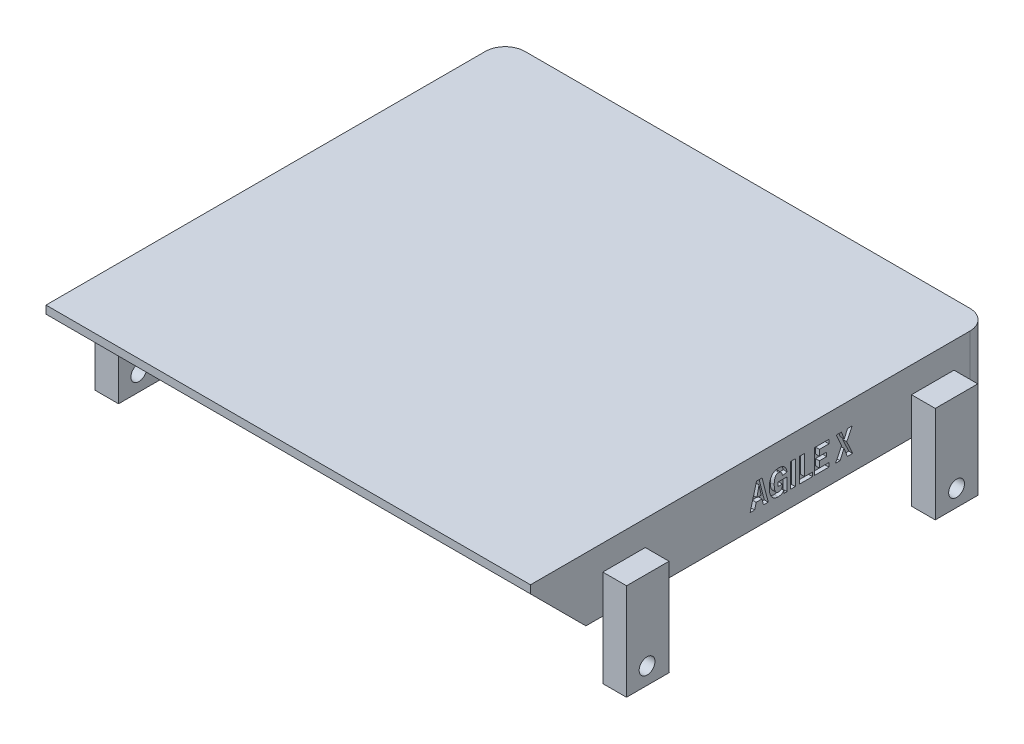
from build123d import *

# Parameters (mm, degrees)
SKETCH1_W           = 612
SKETCH1_H           = 580
BOSS_EXTRUDE1_DEPTH = 80
CHAMFER1_SIZE       = 70
FILLET2_R           = 25
CUT_EXTRUDE1_DEPTH  = 5
SKETCH3_W           = 6.25
SKETCH3_H           = 30.416666667
CUT_EXTRUDE2_DEPTH  = 5
SKETCH4_R           = 10
BOSS_EXTRUDE2_DEPTH = 30
BOSS_EXTRUDE3_START = 30
SKETCH6_W           = 54
SKETCH6_H           = 122
SKETCH6_R           = 10
BOSS_EXTRUDE3_DEPTH = 30


with BuildPart() as part:
    # Sketch1 → Boss-Extrude1 (new body)
    with BuildSketch(Plane(origin=(0, 0, 0), x_dir=(1, 0, 0), z_dir=(0, 1, 0))):
        with Locations((0, 83.030821918)):
            Rectangle(SKETCH1_W, SKETCH1_H)
    extrude(amount=BOSS_EXTRUDE1_DEPTH)

    # Chamfer1
    chamfer1_edges = [part.edges().sort_by_distance(p)[0] for p in [
        (0, 0, 206.969178082),
    ]]
    chamfer(chamfer1_edges, length=CHAMFER1_SIZE)

    # Fillet2
    fillet2_edges = [part.edges().sort_by_distance(p)[0] for p in [
        (-306, 40, -373.030821918),
        (306, 40, -373.030821918),
    ]]
    fillet(fillet2_edges, radius=FILLET2_R)

    # Sketch2 → Cut-Extrude1 (cut)
    # profile 1 of 7: a face of its own
    with BuildSketch(Plane(origin=(0, -68.484589041, 68.484589041), x_dir=(1, 0, 0), z_dir=(0, -0.707106781186549, 0.707106781186546))):
        with BuildLine():
            Line((-47.669619664, 159.046095654), (-52.936546748, 157.333856071))
            add(Edge.make_bspline(
                [(-52.936546748, 157.333856071), (-53.068046863, 157.729443988), (-53.313262961, 158.467120339), (-53.763551866, 159.457045715), (-54.233218552, 160.26316042), (-54.743787602, 160.897229984), (-55.328460328, 161.373021006), (-56.007950138, 161.691260127), (-56.780263593, 161.883319174), (-57.325550467, 161.905550553), (-57.611025914, 161.917189404)],
                knots=[0, 0, 0, 0, 1.402246929, 2.61485337, 3.653289749, 4.535177843, 5.340514958, 6.16703673, 7.040383995, 8, 8, 8, 8], degree=3))
            add(Edge.make_bspline(
                [(-57.611025914, 161.917189404), (-57.824974633, 161.906598538), (-58.236327014, 161.886235818), (-58.821537211, 161.710160408), (-59.341477043, 161.41867419), (-59.781687212, 161.010144928), (-60.139868753, 160.523509876), (-60.398320043, 159.96813141), (-60.55932493, 159.354558371), (-60.577111895, 158.923421839), (-60.586286331, 158.701043571)],
                knots=[0, 0, 0, 0, 1.044354365, 2.007946849, 2.958300523, 3.934837063, 4.921812007, 5.894998498, 6.914249768, 8, 8, 8, 8], degree=3))
            add(Edge.make_bspline(
                [(-60.586286331, 158.701043571), (-60.57422555, 158.46322085), (-60.551009224, 158.005425451), (-60.360981821, 157.358910276), (-60.032606504, 156.801210971), (-59.648686452, 156.41427141), (-59.270697907, 156.131367409), (-58.908589267, 155.917666826), (-58.493643467, 155.669739066), (-58.000722544, 155.43015963), (-57.450056238, 155.156943744), (-56.823189984, 154.892538721), (-56.14029929, 154.591826763), (-55.656547602, 154.404375349), (-55.403994664, 154.306512321)],
                knots=[0, 0, 0, 0, 1.172216551, 2.256451115, 3.288663753, 4.333795424, 4.922807237, 5.615277932, 6.406970191, 7.307380183, 8.318034558, 9.440214458, 10.663609091, 12, 12, 12, 12], degree=3))
            add(Edge.make_bspline(
                [(-55.403994664, 154.306512321), (-54.907821465, 154.10806428), (-53.969720475, 153.732864041), (-52.665037286, 153.15153094), (-51.546053284, 152.577282367), (-50.58358355, 152.015218506), (-49.753512469, 151.405779676), (-49.025303994, 150.720629948), (-48.39321841, 149.935481284), (-47.838593164, 149.079247799), (-47.383751571, 148.1468238), (-47.067412852, 147.144262717), (-46.872718699, 146.082712679), (-46.84861522, 145.355542161), (-46.836286331, 144.983595654)],
                knots=[0, 0, 0, 0, 1.409601274, 2.665094267, 3.766011238, 4.726167811, 5.602043479, 6.476721061, 7.3555848, 8.254339982, 9.163265252, 10.082943167, 11.019428626, 12, 12, 12, 12], degree=3))
            add(Edge.make_bspline(
                [(-46.836286331, 144.983595654), (-46.845236351, 144.674961034), (-46.862902194, 144.065767937), (-46.997445547, 143.169445863), (-47.211606613, 142.30260374), (-47.518358712, 141.465881753), (-47.921002747, 140.66153876), (-48.403553836, 139.884661164), (-48.973981999, 139.138435015), (-49.628352711, 138.432529797), (-50.36071726, 137.780744711), (-51.173210065, 137.208649092), (-52.065627918, 136.734658115), (-53.029703763, 136.342116202), (-54.067712442, 136.036224686), (-55.182193824, 135.825204837), (-56.368694453, 135.692917898), (-57.185317223, 135.675916671), (-57.604515498, 135.667189404)],
                knots=[0, 0, 0, 0, 0.927273364, 1.830282462, 2.717705701, 3.607044279, 4.502508163, 5.416474009, 6.351786542, 7.320982513, 8.30513949, 9.293092817, 10.299813176, 11.335361109, 12.416744679, 13.54621127, 14.740392699, 16, 16, 16, 16], degree=3))
            add(Edge.make_bspline(
                [(-57.604515498, 135.667189404), (-57.949927654, 135.671866196), (-58.625281983, 135.681010321), (-59.610561029, 135.798367479), (-60.545685889, 135.969528446), (-61.430546725, 136.218204741), (-62.264174028, 136.538260917), (-63.053404283, 136.92066586), (-63.785413757, 137.388711462), (-64.46969756, 137.922985576), (-65.10595404, 138.525300719), (-65.687013577, 139.200040029), (-66.216011054, 139.945857738), (-66.690528964, 140.765124054), (-67.119733867, 141.65053842), (-67.499094754, 142.607645417), (-67.822427319, 143.635906381), (-67.997013223, 144.351007382), (-68.086286331, 144.716668571)],
                knots=[0, 0, 0, 0, 1.08993429, 2.13105367, 3.128136037, 4.08903938, 5.028101157, 5.944288876, 6.852861716, 7.765661458, 8.681644202, 9.614310478, 10.572474108, 11.564269381, 12.600009197, 13.676378099, 14.811834491, 16, 16, 16, 16], degree=3))
            Line((-68.086286331, 144.716668571), (-62.389671748, 146.083856071))
            add(Edge.make_bspline(
                [(-62.389671748, 146.083856071), (-62.339830716, 145.864098797), (-62.243034823, 145.437309843), (-62.064529646, 144.823186383), (-61.873671907, 144.249030693), (-61.649194897, 143.720351557), (-61.410844862, 143.231738811), (-61.149123936, 142.784434055), (-60.864101392, 142.380998617), (-60.555057793, 142.021156939), (-60.230861366, 141.697101488), (-59.875284333, 141.425382525), (-59.50373817, 141.185470791), (-59.103266946, 140.999756933), (-58.686095712, 140.84640602), (-58.24623859, 140.745537286), (-57.78687916, 140.675669411), (-57.47241651, 140.670059347), (-57.311546748, 140.667189404)],
                knots=[0, 0, 0, 0, 1.330535481, 2.584022976, 3.775635058, 4.901540113, 5.973405712, 6.984548086, 7.958957425, 8.886202164, 9.783465393, 10.6602652, 11.524326317, 12.390001883, 13.261634327, 14.144502024, 15.050782285, 16, 16, 16, 16], degree=3))
            add(Edge.make_bspline(
                [(-57.311546748, 140.667189404), (-56.980338929, 140.677029279), (-56.356431453, 140.695564987), (-55.485428552, 140.902474831), (-54.735160117, 141.228235767), (-54.134436166, 141.710886458), (-53.668199838, 142.283149879), (-53.3302015, 142.927166457), (-53.119486197, 143.635957151), (-53.097514649, 144.131430895), (-53.086286331, 144.384637321)],
                knots=[0, 0, 0, 0, 1.248895472, 2.352587042, 3.361559477, 4.312925947, 5.233592161, 6.132088199, 7.045424151, 8, 8, 8, 8], degree=3))
            add(Edge.make_bspline(
                [(-53.086286331, 144.384637321), (-53.094594638, 144.572172777), (-53.111264091, 144.948436397), (-53.261618703, 145.498930109), (-53.502645101, 146.029068658), (-53.777067011, 146.45810491), (-54.076971726, 146.792704255), (-54.382669683, 147.055390468), (-54.768344765, 147.316842693), (-55.225423736, 147.589488029), (-55.756724931, 147.872092317), (-56.369062112, 148.151713488), (-57.051051978, 148.456511052), (-57.538404364, 148.642712202), (-57.793317581, 148.740106071)],
                knots=[0, 0, 0, 0, 0.979831158, 1.96589394, 2.962105149, 4.020392989, 4.615464502, 5.307704592, 6.123587612, 7.050601816, 8.092000183, 9.270601893, 10.572368426, 12, 12, 12, 12], degree=3))
            add(Edge.make_bspline(
                [(-57.793317581, 148.740106071), (-58.077867372, 148.850120066), (-58.628537164, 149.063022644), (-59.422670559, 149.382503333), (-60.157308064, 149.686066327), (-60.829198033, 149.981158728), (-61.443951956, 150.25783623), (-61.993684788, 150.534644675), (-62.491625513, 150.783268849), (-63.068469118, 151.115582245), (-63.733486843, 151.572345409), (-64.449918876, 152.241194792), (-65.121273782, 153.012895537), (-65.712285707, 153.901119704), (-66.218443066, 154.876051142), (-66.575534826, 155.936144037), (-66.797602439, 157.059833109), (-66.823219263, 157.831935788), (-66.836286331, 158.225783154)],
                knots=[0, 0, 0, 0, 1.033116979, 1.999320784, 2.898737521, 3.724784007, 4.484447603, 5.181218081, 5.808996273, 6.368686919, 7.434939515, 8.532418519, 9.678689388, 10.891468741, 12.137135469, 13.387476061, 14.66735902, 16, 16, 16, 16], degree=3))
            add(Edge.make_bspline(
                [(-66.836286331, 158.225783154), (-66.828841193, 158.525619621), (-66.814162087, 159.116788155), (-66.696200208, 159.985559567), (-66.493463221, 160.816248097), (-66.211135688, 161.609885522), (-65.853087171, 162.367937681), (-65.41171416, 163.088117301), (-64.896456636, 163.77587715), (-64.29924963, 164.415808918), (-63.636641745, 165.000331524), (-62.921713542, 165.517669298), (-62.150410242, 165.948202122), (-61.335307023, 166.310823312), (-60.462746842, 166.582222573), (-59.540799419, 166.776531425), (-58.569010784, 166.895804316), (-57.904336893, 166.909968034), (-57.565452998, 166.917189404)],
                knots=[0, 0, 0, 0, 1.010374096, 1.992090487, 2.948324196, 3.887622084, 4.82666361, 5.768776881, 6.729921826, 7.718481422, 8.713487715, 9.704101857, 10.686689868, 11.685613842, 12.705816172, 13.760266775, 14.858072314, 16, 16, 16, 16], degree=3))
            add(Edge.make_bspline(
                [(-57.565452998, 166.917189404), (-57.246231868, 166.910683973), (-56.623810354, 166.8979996), (-55.71161043, 166.806424101), (-54.845570837, 166.650363275), (-54.022575585, 166.435580897), (-53.242609712, 166.164260377), (-52.511002498, 165.820681163), (-51.817342598, 165.427673677), (-51.17508475, 164.958159723), (-50.577861286, 164.433037277), (-50.025339335, 163.845936866), (-49.515804422, 163.200193351), (-49.055409557, 162.487899446), (-48.63558109, 161.715964698), (-48.269525502, 160.879307078), (-47.931269417, 159.988794381), (-47.758000665, 159.364523844), (-47.669619664, 159.046095654)],
                knots=[0, 0, 0, 0, 1.110600657, 2.165463621, 3.185931529, 4.169413596, 5.122273899, 6.054660352, 6.978106896, 7.891871227, 8.817414554, 9.741478292, 10.693141157, 11.675376052, 12.688976763, 13.746969891, 14.85077341, 16, 16, 16, 16], degree=3))
        make_face()
    # profile 2 of 7: a face of its own
    with BuildSketch(Plane(origin=(0, -68.484589041, 68.484589041), x_dir=(1, 0, 0), z_dir=(0, -0.707106781186549, 0.707106781186546))):
        with BuildLine():
            Line((-28.021182164, 146.917189404), (-22.252952998, 146.181512321))
            add(Edge.make_bspline(
                [(-22.252952998, 146.181512321), (-22.320092876, 145.755375848), (-22.450581891, 144.927162721), (-22.715030051, 143.731476243), (-23.048546305, 142.620531602), (-23.437261985, 141.590179482), (-23.884025368, 140.63909373), (-24.40374506, 139.778636734), (-24.967252886, 138.988513597), (-25.604812105, 138.289519888), (-26.295409229, 137.668963253), (-27.043814947, 137.127478957), (-27.858765908, 136.677958751), (-28.731304927, 136.306826367), (-29.665623217, 136.019907017), (-30.654788438, 135.813423674), (-31.704941388, 135.68647365), (-32.424025922, 135.673732648), (-32.793317581, 135.667189404)],
                knots=[0, 0, 0, 0, 1.249385357, 2.428229969, 3.543891733, 4.606271744, 5.615669577, 6.582663251, 7.514362023, 8.42219658, 9.316944747, 10.19966651, 11.091672485, 12.007027399, 12.941499877, 13.917907229, 14.930724474, 16, 16, 16, 16], degree=3))
            add(Edge.make_bspline(
                [(-32.793317581, 135.667189404), (-33.249890043, 135.678122003), (-34.13526067, 135.699322148), (-35.417180547, 135.908157066), (-36.609536331, 136.236972902), (-37.715433181, 136.700479948), (-38.726648032, 137.305169943), (-39.645426757, 138.043991203), (-40.481373853, 138.907698751), (-41.204153615, 139.914232566), (-41.846948305, 141.018860016), (-42.397461735, 142.218877809), (-42.877663135, 143.498287918), (-43.256744048, 144.869890287), (-43.555369781, 146.325121908), (-43.769765756, 147.864529807), (-43.89152324, 149.491167577), (-43.910092818, 150.604052712), (-43.919619664, 151.175001904)],
                knots=[0, 0, 0, 0, 1.014679835, 1.967634486, 2.879863779, 3.76012518, 4.62591189, 5.491214183, 6.375277913, 7.290413538, 8.2398786, 9.213723471, 10.223167179, 11.275940032, 12.374873334, 13.524970968, 14.730223111, 16, 16, 16, 16], degree=3))
            add(Edge.make_bspline(
                [(-43.919619664, 151.175001904), (-43.911320105, 151.785066893), (-43.895171458, 152.972084736), (-43.757344363, 154.700595351), (-43.530346551, 156.322172135), (-43.225086345, 157.839374141), (-42.811737128, 159.241843531), (-42.32117845, 160.542325036), (-41.724738175, 161.730121167), (-41.0504001, 162.815831351), (-40.28866203, 163.785710723), (-39.437245757, 164.628443535), (-38.498042271, 165.332131782), (-37.489044451, 165.924037911), (-36.386653829, 166.362114858), (-35.211802888, 166.692076753), (-33.951661153, 166.879798424), (-33.086889295, 166.904517546), (-32.643577998, 166.917189404)],
                knots=[0, 0, 0, 0, 1.336722099, 2.600891725, 3.796662543, 4.923314773, 5.98874742, 6.997326191, 7.96499444, 8.896546895, 9.793732702, 10.661329326, 11.513527377, 12.359385929, 13.21687505, 14.105283766, 15.028704389, 16, 16, 16, 16], degree=3))
            add(Edge.make_bspline(
                [(-32.643577998, 166.917189404), (-32.280869337, 166.907576326), (-31.57283013, 166.888810753), (-30.538583078, 166.767677111), (-29.565841002, 166.549358039), (-28.646306641, 166.260595212), (-27.789524916, 165.872661242), (-26.989832511, 165.402115584), (-26.249896515, 164.844789193), (-25.568771272, 164.202743281), (-24.949279041, 163.472804996), (-24.379217573, 162.665162328), (-23.881248207, 161.764099832), (-23.42806238, 160.787376344), (-23.049946857, 159.71897253), (-22.713644574, 158.570836007), (-22.451757739, 157.333385573), (-22.320352311, 156.477352228), (-22.252952998, 156.038283154)],
                knots=[0, 0, 0, 0, 1.040169375, 2.030502107, 2.980212413, 3.895345935, 4.789438109, 5.671011458, 6.550957922, 7.44022922, 8.349440173, 9.292090098, 10.270086596, 11.297575872, 12.376345336, 13.516666938, 14.726270705, 16, 16, 16, 16], degree=3))
            Line((-22.252952998, 156.038283154), (-28.034202998, 155.250522737))
            add(Edge.make_bspline(
                [(-28.034202998, 155.250522737), (-28.069288348, 155.519875496), (-28.137371086, 156.042551572), (-28.266178872, 156.799119195), (-28.421878954, 157.50326923), (-28.602370393, 158.156119805), (-28.812584534, 158.75472595), (-29.035863732, 159.307280975), (-29.299209467, 159.80059409), (-29.577401056, 160.248138807), (-29.884682133, 160.641411167), (-30.217816197, 160.983397862), (-30.577457966, 161.270435284), (-30.958628754, 161.509150894), (-31.366076829, 161.692743557), (-31.799404796, 161.822810163), (-32.258659271, 161.903108819), (-32.573801281, 161.91242979), (-32.734723831, 161.917189404)],
                knots=[0, 0, 0, 0, 1.44906061, 2.811886229, 4.092776894, 5.295072586, 6.42281182, 7.476380238, 8.47071313, 9.402194461, 10.284607749, 11.127872692, 11.943338893, 12.733679525, 13.521301866, 14.319741845, 15.142001328, 16, 16, 16, 16], degree=3))
            add(Edge.make_bspline(
                [(-32.734723831, 161.917189404), (-32.934987118, 161.907726232), (-33.326414761, 161.889229846), (-33.895320756, 161.764710085), (-34.424811491, 161.54742909), (-34.908285006, 161.234574334), (-35.359478388, 160.845732961), (-35.761933851, 160.363312377), (-36.127698102, 159.798740514), (-36.449871637, 159.147692418), (-36.746687933, 158.416374256), (-36.986339015, 157.591900109), (-37.202196077, 156.686393008), (-37.377755806, 155.695320731), (-37.502096336, 154.618747027), (-37.601242826, 153.457344902), (-37.65909295, 152.20857477), (-37.666036118, 151.346502076), (-37.669619664, 150.901564404)],
                knots=[0, 0, 0, 0, 0.721707156, 1.410623662, 2.087534721, 2.773246533, 3.477446831, 4.226608229, 5.029348627, 5.896889418, 6.841025437, 7.870447894, 8.987931594, 10.195492518, 11.495574795, 12.892831787, 14.396311354, 16, 16, 16, 16], degree=3))
            add(Edge.make_bspline(
                [(-37.669619664, 150.901564404), (-37.6660482, 150.489173335), (-37.65912698, 149.689991629), (-37.600973985, 148.530146047), (-37.501933262, 147.449027522), (-37.378242662, 146.445950767), (-37.201915847, 145.524337089), (-36.98606515, 144.683897882), (-36.746048843, 143.917734552), (-36.449199784, 143.238472279), (-36.125835329, 142.633619949), (-35.762781599, 142.107435262), (-35.352360469, 141.665727618), (-34.909981031, 141.29549954), (-34.421588011, 141.010050259), (-33.891478204, 140.817619954), (-33.327074846, 140.685798237), (-32.935161028, 140.673486181), (-32.734723831, 140.667189404)],
                knots=[0, 0, 0, 0, 1.570196963, 3.042919158, 4.420193128, 5.703406983, 6.889682038, 7.989955834, 9.006459428, 9.942825837, 10.808054535, 11.614972758, 12.369277943, 13.097187235, 13.804400205, 14.510405295, 15.238173869, 16, 16, 16, 16], degree=3))
            add(Edge.make_bspline(
                [(-32.734723831, 140.667189404), (-32.565302675, 140.673161073), (-32.23604992, 140.684766404), (-31.756702696, 140.746666842), (-31.311743838, 140.866023793), (-30.898922872, 141.026448626), (-30.522725379, 141.240574917), (-30.175398288, 141.49188471), (-29.867367192, 141.799022391), (-29.584042218, 142.146996993), (-29.329055225, 142.550296894), (-29.098097862, 143.008379179), (-28.874225825, 143.520575478), (-28.668838671, 144.090600151), (-28.480490527, 144.716640705), (-28.312036674, 145.399473558), (-28.156918848, 146.138003913), (-28.067355, 146.652137966), (-28.021182164, 146.917189404)],
                knots=[0, 0, 0, 0, 0.937545461, 1.82202408, 2.66641249, 3.480034922, 4.264717236, 5.054615877, 5.844058324, 6.663328528, 7.532440888, 8.477334956, 9.49873695, 10.622766397, 11.826586643, 13.113428642, 14.511886372, 16, 16, 16, 16], degree=3))
        make_face()
    # profile 3 of 7: a face of its own
    with BuildSketch(Plane(origin=(0, -68.484589041, 68.484589041), x_dir=(1, 0, 0), z_dir=(0, -0.707106781186549, 0.707106781186546))):
        with BuildLine():
            add(Edge.make_bspline(
                [(3.163713669, 151.305210237), (3.155442568, 150.692974921), (3.139377013, 149.503786165), (3.001844057, 147.775234083), (2.774581109, 146.157941552), (2.468717331, 144.647485586), (2.056773534, 143.247868987), (1.558291233, 141.957301695), (0.970880639, 140.772299414), (0.288793372, 139.703880771), (-0.482716146, 138.749569565), (-1.349264395, 137.919765224), (-2.311216238, 137.220123535), (-3.365005425, 136.649518867), (-4.506069629, 136.203549409), (-5.742229726, 135.894970685), (-7.066848559, 135.703415483), (-7.981445906, 135.679476343), (-8.450869664, 135.667189404)],
                knots=[0, 0, 0, 0, 1.326950474, 2.57743149, 3.755596254, 4.865442852, 5.914825436, 6.914178502, 7.860850126, 8.776884433, 9.656290029, 10.514698441, 11.369982024, 12.226700311, 13.105489209, 14.018220213, 14.982837072, 16, 16, 16, 16], degree=3))
            add(Edge.make_bspline(
                [(-8.450869664, 135.667189404), (-8.896362274, 135.680130612), (-9.763009439, 135.705306025), (-11.023783556, 135.888089227), (-12.202085429, 136.199258977), (-13.297896982, 136.640085029), (-14.318948701, 137.195105743), (-15.254717746, 137.88427443), (-16.106786819, 138.700810801), (-16.878097754, 139.638039764), (-17.561932757, 140.695127655), (-18.146315769, 141.872933933), (-18.652248366, 143.1606963), (-19.045511594, 144.569916405), (-19.368499413, 146.089257119), (-19.590200589, 147.725638363), (-19.728855079, 149.477711475), (-19.744765168, 150.684274926), (-19.752952998, 151.305210237)],
                knots=[0, 0, 0, 0, 0.97710851, 1.900835841, 2.787711236, 3.644350247, 4.485934983, 5.330530572, 6.185819189, 7.068455028, 7.987521047, 8.941342163, 9.948299617, 11.018138869, 12.146992335, 13.353494975, 14.638025692, 16, 16, 16, 16], degree=3))
            add(Edge.make_bspline(
                [(-19.752952998, 151.305210237), (-19.745057389, 151.921839339), (-19.729745839, 153.117636555), (-19.587597034, 154.853833708), (-19.37607212, 156.478156938), (-19.053496297, 157.98687172), (-18.654624656, 159.3867428), (-18.159691598, 160.675351642), (-17.575817159, 161.853687075), (-16.895782853, 162.913929248), (-16.133407701, 163.859576252), (-15.281117908, 164.677779664), (-14.351198021, 165.37806754), (-13.328926857, 165.938620227), (-12.231185884, 166.38517693), (-11.047682962, 166.696840547), (-9.784657568, 166.878663137), (-8.915882992, 166.904130493), (-8.470400914, 166.917189404)],
                knots=[0, 0, 0, 0, 1.355125482, 2.627925398, 3.826706912, 4.953122008, 6.015906423, 7.023124882, 7.983092984, 8.901387517, 9.786434376, 10.646710646, 11.491978037, 12.337528034, 13.202065377, 14.090691464, 15.020962678, 16, 16, 16, 16], degree=3))
            add(Edge.make_bspline(
                [(-8.470400914, 166.917189404), (-8.00314069, 166.905009937), (-7.094999898, 166.881338608), (-5.778997824, 166.689039056), (-4.55012414, 166.379103159), (-3.408350785, 165.936744249), (-2.360572432, 165.355891964), (-1.392349339, 164.663719), (-0.519835416, 163.834453341), (0.253950069, 162.874744026), (0.945458089, 161.806255913), (1.536394906, 160.622150732), (2.047898404, 159.336587054), (2.44994629, 157.936783098), (2.779729255, 156.435048204), (3.000333837, 154.82185011), (3.139804347, 153.1002261), (3.155587264, 151.915308059), (3.163713669, 151.305210237)],
                knots=[0, 0, 0, 0, 1.013968525, 1.970692416, 2.880215938, 3.760310776, 4.620562613, 5.474353261, 6.337451213, 7.224791509, 8.14473585, 9.094930477, 10.093104066, 11.144046104, 12.252893147, 13.428144117, 14.675787171, 16, 16, 16, 16], degree=3))
        make_face()
        with BuildLine():
            add(Edge.make_bspline(
                [(-3.086286331, 151.292189404), (-3.089936851, 151.700236307), (-3.097047689, 152.495069775), (-3.154763424, 153.650614971), (-3.25493495, 154.73589709), (-3.377879815, 155.752119614), (-3.557867257, 156.695917806), (-3.760705559, 157.574490398), (-4.015345496, 158.37814755), (-4.300222968, 159.114187518), (-4.625655221, 159.776285605), (-5.018326394, 160.348779246), (-5.468489082, 160.830469662), (-5.965395482, 161.236106905), (-6.526382544, 161.544244443), (-7.142613743, 161.759351946), (-7.811588334, 161.891625708), (-8.276632979, 161.908503199), (-8.515973831, 161.917189404)],
                knots=[0, 0, 0, 0, 1.466210989, 2.856028448, 4.155770801, 5.382215779, 6.532361573, 7.606676073, 8.620326332, 9.558682287, 10.440994406, 11.265114454, 12.043079949, 12.803015134, 13.560425543, 14.329942543, 15.140484725, 16, 16, 16, 16], degree=3))
            add(Edge.make_bspline(
                [(-8.515973831, 161.917189404), (-8.72484921, 161.907619539), (-9.133331413, 161.888904459), (-9.726469301, 161.766213433), (-10.273359268, 161.547716483), (-10.778051435, 161.243010399), (-11.232942683, 160.847361923), (-11.64994595, 160.371893945), (-12.012834022, 159.805951457), (-12.328685844, 159.156916318), (-12.60860691, 158.431303407), (-12.8442384, 157.628571201), (-13.055999116, 156.756333329), (-13.213289641, 155.806869606), (-13.34259004, 154.78395444), (-13.442258639, 153.685399803), (-13.490126537, 152.512241885), (-13.498595033, 151.706718901), (-13.502952998, 151.292189404)],
                knots=[0, 0, 0, 0, 0.770472682, 1.506756713, 2.22171639, 2.932812122, 3.670791109, 4.4365927, 5.258059392, 6.142258441, 7.095097296, 8.123232389, 9.225996534, 10.403774659, 11.670637884, 13.028717385, 14.470950782, 16, 16, 16, 16], degree=3))
            add(Edge.make_bspline(
                [(-13.502952998, 151.292189404), (-13.498822544, 150.881981218), (-13.490798596, 150.085098116), (-13.43987094, 148.925386653), (-13.350747297, 147.837002056), (-13.219469193, 146.820850564), (-13.060294995, 145.874692401), (-12.858816257, 144.998291926), (-12.619147233, 144.193916902), (-12.349812487, 143.458762621), (-12.032030411, 142.804686299), (-11.669093792, 142.232894601), (-11.25433106, 141.748092785), (-10.786643809, 141.351607726), (-10.269568986, 141.043153591), (-9.703741874, 140.825670043), (-9.090710387, 140.692511365), (-8.664237241, 140.675803517), (-8.444359248, 140.667189404)],
                knots=[0, 0, 0, 0, 1.505083072, 2.923820902, 4.258205982, 5.510506901, 6.682089502, 7.777230645, 8.807584829, 9.760015624, 10.646706658, 11.470536082, 12.23831951, 12.978480114, 13.710414782, 14.436435432, 15.193868492, 16, 16, 16, 16], degree=3))
            add(Edge.make_bspline(
                [(-8.444359248, 140.667189404), (-8.211591174, 140.676365903), (-7.76212709, 140.694085287), (-7.111781127, 140.818816926), (-6.512252212, 141.033184512), (-5.968531933, 141.345078948), (-5.472212088, 141.733007778), (-5.032043624, 142.211984259), (-4.639708961, 142.773463597), (-4.313079361, 143.42733571), (-4.02014673, 144.152527706), (-3.766946916, 144.953399565), (-3.563051191, 145.831800389), (-3.386710525, 146.780808033), (-3.252003306, 147.804435294), (-3.155618252, 148.901340065), (-3.096718292, 150.071923203), (-3.089830435, 150.877622074), (-3.086286331, 151.292189404)],
                knots=[0, 0, 0, 0, 0.839936334, 1.621877123, 2.380114191, 3.127264848, 3.874743923, 4.6451431, 5.466539097, 6.338869643, 7.277080878, 8.287827586, 9.366981327, 10.530009588, 11.770763197, 13.091963666, 14.503688037, 16, 16, 16, 16], degree=3))
        make_face(mode=Mode.SUBTRACT)
    # profile 4 of 7: a face of its own
    with BuildSketch(Plane(origin=(0, -68.484589041, 68.484589041), x_dir=(1, 0, 0), z_dir=(0, -0.707106781186549, 0.707106781186546))):
        with BuildLine():
            Line((7.330380336, 166.500522737), (13.580380336, 166.500522737))
            Line((13.580380336, 166.500522737), (13.580380336, 147.893751904))
            add(Edge.make_bspline(
                [(13.580380336, 147.893751904), (13.581948086, 147.644177081), (13.584961096, 147.164527133), (13.598990385, 146.470077336), (13.615244902, 145.829592382), (13.649593977, 145.241531614), (13.687978713, 144.709747613), (13.731330878, 144.229444656), (13.790456902, 143.804142653), (13.872063475, 143.317975415), (14.016271133, 142.783964874), (14.255091785, 142.214343438), (14.568600099, 141.728979278), (14.961622139, 141.337790003), (15.421024532, 141.031162062), (15.94983472, 140.815734736), (16.545828741, 140.693952599), (16.963059918, 140.676362448), (17.180640752, 140.667189404)],
                knots=[0, 0, 0, 0, 1.296754236, 2.492190901, 3.608997368, 4.625375005, 5.552454049, 6.379355617, 7.13043896, 7.782969722, 8.940034309, 9.99568291, 10.980807245, 11.92163566, 12.856703087, 13.832490769, 14.86967108, 16, 16, 16, 16], degree=3))
            add(Edge.make_bspline(
                [(17.180640752, 140.667189404), (17.422119359, 140.673522641), (17.877909476, 140.685476605), (18.515693525, 140.803867213), (19.069207295, 140.988845217), (19.538784884, 141.262014669), (19.929039591, 141.617109447), (20.256436266, 142.039320907), (20.52677084, 142.530854969), (20.701308, 143.000683948), (20.80796341, 143.44282252), (20.889599308, 143.856812733), (20.940165743, 144.35162775), (20.995689191, 144.924164091), (21.02977454, 145.575872521), (21.067124584, 146.306981321), (21.074323754, 147.116846132), (21.078305603, 147.683259166), (21.080380336, 147.978387321)],
                knots=[0, 0, 0, 0, 1.20854193, 2.28111913, 3.236980579, 4.11894516, 4.981189837, 5.864158973, 6.783910903, 7.781521939, 8.364259501, 9.061503129, 9.893540458, 10.854212389, 11.943356947, 13.162221823, 14.521382481, 16, 16, 16, 16], degree=3))
            Line((21.080380336, 147.978387321), (21.080380336, 166.500522737))
            Line((21.080380336, 166.500522737), (26.913713669, 166.500522737))
            Line((26.913713669, 166.500522737), (26.913713669, 148.128126904))
            add(Edge.make_bspline(
                [(26.913713669, 148.128126904), (26.913939408, 147.780856243), (26.91437689, 147.107844878), (26.875641924, 146.127058613), (26.837450837, 145.203819779), (26.760105403, 144.338437519), (26.682633494, 143.529444475), (26.56693898, 142.781598085), (26.449096823, 142.089016334), (26.297085922, 141.449809976), (26.117170064, 140.848159595), (25.879986627, 140.276588007), (25.587385763, 139.728039603), (25.231268979, 139.206139806), (24.825843821, 138.703783461), (24.369908503, 138.21889619), (23.852637179, 137.765469511), (23.288050888, 137.333999852), (22.667521789, 136.94356331), (21.996873728, 136.595777477), (21.269063027, 136.310743676), (20.490708577, 136.078811526), (19.665243356, 135.88746917), (18.785421853, 135.76066115), (17.857035008, 135.681262006), (17.219872715, 135.671949541), (16.894182419, 135.667189404)],
                knots=[0, 0, 0, 0, 1.34178831, 2.600388923, 3.792648795, 4.911796733, 5.957361409, 6.932233184, 7.835317641, 8.67131525, 9.469750024, 10.259327788, 11.058466882, 11.867880075, 12.696908628, 13.551130172, 14.436281706, 15.352048165, 16.294309201, 17.265712184, 18.267024629, 19.309625642, 20.402062792, 21.538236051, 22.741650853, 24, 24, 24, 24], degree=3))
            add(Edge.make_bspline(
                [(16.894182419, 135.667189404), (16.420452768, 135.679449428), (15.499429929, 135.703285306), (14.163597977, 135.894643298), (12.919576005, 136.207253223), (11.947695986, 136.565144569), (11.233762643, 136.936033149), (10.734817462, 137.246619449), (10.265666644, 137.593815963), (9.836706229, 137.986807462), (9.437697006, 138.417659398), (9.074407315, 138.887731498), (8.738753159, 139.393094586), (8.432501188, 139.947067508), (8.16922687, 140.579938005), (7.94499231, 141.306339775), (7.750026413, 142.13484436), (7.599090297, 143.068605653), (7.474384419, 144.104438952), (7.394668859, 145.245174668), (7.341685094, 146.489170911), (7.334247303, 147.353325315), (7.330380336, 147.802606071)],
                knots=[0, 0, 0, 0, 1.577757004, 3.067467349, 4.484289742, 5.845819582, 6.505478295, 7.161481921, 7.802045158, 8.446918715, 9.096677594, 9.756138182, 10.423869425, 11.116272846, 11.861505114, 12.702963645, 13.64641987, 14.694743039, 15.852461956, 17.121165739, 18.503271142, 20, 20, 20, 20], degree=3))
            Line((7.330380336, 147.802606071), (7.330380336, 166.500522737))
        make_face()
    # profile 5 of 7: a face of its own
    with BuildSketch(Plane(origin=(0, -68.484589041, 68.484589041), x_dir=(1, 0, 0), z_dir=(0, -0.707106781186549, 0.707106781186546))):
        Polygon((28.580380336, 166.500522737), (48.163713669, 166.500522737), (48.163713669, 161.500522737), (41.497047002, 161.500522737), (41.497047002, 136.083856071), (35.247047002, 136.083856071), (35.247047002, 161.500522737), (28.580380336, 161.500522737), align=None)
    # profile 6 of 7: a face of its own
    with BuildSketch(Plane(origin=(0, -68.484589041, 68.484589041), x_dir=(1, 0, 0), z_dir=(0, -0.707106781186549, 0.707106781186546))):
        Polygon((58.580380336, 166.500522737), (66.965797002, 166.500522737), (72.226213669, 145.172397737), (77.616838669, 166.500522737), (85.663713669, 166.500522737), (85.663713669, 136.083856071), (79.830380336, 136.083856071), (79.830380336, 161.331251904), (74.088192836, 136.083856071), (69.582984502, 136.083856071), (63.997047002, 161.357293571), (63.997047002, 136.083856071), (58.580380336, 136.083856071), align=None)
    # profile 7 of 7: a face of its own
    with BuildSketch(Plane(origin=(0, -68.484589041, 68.484589041), x_dir=(1, 0, 0), z_dir=(0, -0.707106781186549, 0.707106781186546))):
        Polygon((91.080380336, 166.500522737), (98.059547002, 166.500522737), (106.080380336, 145.133335237), (106.080380336, 166.500522737), (111.497047002, 166.500522737), (111.497047002, 136.083856071), (105.461890752, 136.083856071), (96.497047002, 159.801303987), (96.497047002, 136.083856071), (91.080380336, 136.083856071), align=None)
    extrude(amount=-CUT_EXTRUDE1_DEPTH, mode=Mode.SUBTRACT)

    # Sketch3 → Cut-Extrude2 (cut)
    # profile 1 of 6: a face of its own
    with BuildSketch(Plane(origin=(306, 0, 0), x_dir=(0, 0, -1), z_dir=(1, 0, 0))):
        Polygon((78.554143409, 50.630546454), (85.533310076, 50.630546454), (93.384872576, 20.213879787), (87.297632993, 20.213879787), (85.455185076, 27.713879787), (78.059351743, 27.713879787), (76.255966326, 20.213879787), (70.468205909, 20.213879787), align=None)
        Polygon((84.433049659, 32.29721312), (81.718205909, 45.03158812), (79.074976743, 32.29721312), align=None, mode=Mode.SUBTRACT)
    # profile 2 of 6: a face of its own
    with BuildSketch(Plane(origin=(306, 0, 0), x_dir=(0, 0, -1), z_dir=(1, 0, 0))):
        with BuildLine():
            Line((105.884872576, 36.04721312), (117.134872576, 36.04721312))
            Line((117.134872576, 36.04721312), (117.134872576, 19.79721312))
            Line((117.134872576, 19.79721312), (113.339299659, 19.79721312))
            Line((113.339299659, 19.79721312), (112.896591326, 23.54721312))
            add(Edge.make_bspline(
                [(112.896591326, 23.54721312), (112.75779009, 23.247887342), (112.484406221, 22.658333234), (111.888120213, 21.891078091), (111.18186212, 21.23144241), (110.340421805, 20.70250618), (109.377558615, 20.291657881), (108.290388544, 20.002474335), (107.081961621, 19.82732293), (106.234890853, 19.807524413), (105.793726743, 19.79721312)],
                knots=[0, 0, 0, 0, 0.922196992, 1.816365527, 2.703054826, 3.619294827, 4.586510842, 5.626802067, 6.764011467, 8, 8, 8, 8], degree=3))
            add(Edge.make_bspline(
                [(105.793726743, 19.79721312), (105.365390257, 19.808946023), (104.527934683, 19.831885431), (103.311738029, 20.033474841), (102.166827048, 20.349629892), (101.095524277, 20.804572405), (100.093689419, 21.38535837), (99.167916674, 22.101639128), (98.326140323, 22.953248238), (97.550821112, 23.915711099), (96.864823393, 24.992423133), (96.262006406, 26.161530819), (95.765113684, 27.42711152), (95.34523441, 28.774972239), (95.032890156, 30.213890261), (94.795090488, 31.737194497), (94.660285566, 33.351623612), (94.643477671, 34.458429264), (94.634872576, 35.025077704)],
                knots=[0, 0, 0, 0, 0.966940709, 1.890499439, 2.776626296, 3.644297146, 4.511967997, 5.385600394, 6.279892749, 7.210824362, 8.172182255, 9.158755033, 10.177360661, 11.239470622, 12.344340009, 13.500062634, 14.720113503, 16, 16, 16, 16], degree=3))
            add(Edge.make_bspline(
                [(94.634872576, 35.025077704), (94.643157757, 35.619972897), (94.659327816, 36.781020761), (94.798578344, 38.476736434), (95.022527691, 40.079874756), (95.340823414, 41.590116849), (95.750077513, 43.007561785), (96.249184615, 44.33326331), (96.844604426, 45.564125442), (97.525260936, 46.700878291), (98.300778941, 47.728944009), (99.191232146, 48.616377476), (100.173863377, 49.373094623), (101.259020649, 49.988797215), (102.443256888, 50.468247541), (103.726357595, 50.799124691), (105.1048919, 51.017095506), (106.057598626, 51.036965586), (106.548935076, 51.04721312)],
                knots=[0, 0, 0, 0, 1.26097138, 2.461018588, 3.604159628, 4.69054062, 5.730089432, 6.728935497, 7.689841059, 8.624801575, 9.533914736, 10.412252901, 11.281812003, 12.155450716, 13.049066094, 13.981975647, 14.959250632, 16, 16, 16, 16], degree=3))
            add(Edge.make_bspline(
                [(106.548935076, 51.04721312), (106.911607764, 51.039435391), (107.619165804, 51.024261393), (108.651822685, 50.914277667), (109.626682443, 50.723695128), (110.548322169, 50.467003625), (111.411120756, 50.126505542), (112.21729332, 49.713469528), (112.971083973, 49.231823258), (113.665131365, 48.667986386), (114.297746103, 48.026323451), (114.874918155, 47.310416334), (115.393704881, 46.519070967), (115.865856054, 45.659554593), (116.266938212, 44.719502804), (116.619588033, 43.70875546), (116.911195036, 42.619855243), (117.059083885, 41.864168091), (117.134872576, 41.47690062)],
                knots=[0, 0, 0, 0, 1.102179668, 2.150302771, 3.151491359, 4.118172068, 5.053914054, 5.965399522, 6.867361478, 7.767657937, 8.677112756, 9.601088643, 10.557817762, 11.54953275, 12.577540478, 13.660127111, 14.800883866, 16, 16, 16, 16], degree=3))
            Line((117.134872576, 41.47690062), (111.405705909, 40.213879787))
            add(Edge.make_bspline(
                [(111.405705909, 40.213879787), (111.33145248, 40.520276635), (111.189730722, 41.105072516), (110.960300261, 41.93561306), (110.702662397, 42.671814052), (110.44736378, 43.324781024), (110.175764451, 43.888268125), (109.888257432, 44.361490259), (109.593143977, 44.752944516), (109.17378519, 45.139508781), (108.610505722, 45.506639622), (107.882103484, 45.823102402), (107.091920312, 46.009001318), (106.547742052, 46.034269509), (106.268987159, 46.04721312)],
                knots=[0, 0, 0, 0, 1.322723607, 2.52457987, 3.612964129, 4.593571453, 5.464964067, 6.233220374, 6.91437199, 7.513417656, 8.616929593, 9.717997426, 10.831045948, 12, 12, 12, 12], degree=3))
            add(Edge.make_bspline(
                [(106.268987159, 46.04721312), (106.051367948, 46.04052677), (105.625424404, 46.027439654), (105.008359253, 45.900946238), (104.433029132, 45.690707721), (103.902535933, 45.394779059), (103.41350077, 45.017299153), (102.970486556, 44.557745888), (102.568415954, 44.014897299), (102.215163235, 43.386827556), (101.89377833, 42.680054514), (101.623731632, 41.889978387), (101.397576476, 41.018791921), (101.21091549, 40.066331346), (101.060549184, 39.030109577), (100.961705437, 37.910713275), (100.89304612, 36.709962734), (100.887657163, 35.882389654), (100.884872576, 35.454765204)],
                knots=[0, 0, 0, 0, 0.788418469, 1.543162272, 2.272701869, 3.001944257, 3.737065852, 4.50510995, 5.309433315, 6.180166129, 7.113519996, 8.121529392, 9.203880472, 10.37535255, 11.639711727, 12.999201272, 14.449424061, 16, 16, 16, 16], degree=3))
            add(Edge.make_bspline(
                [(100.884872576, 35.454765204), (100.88799192, 35.02500149), (100.894045452, 34.190983694), (100.958366611, 32.98310816), (101.070180662, 31.858278218), (101.215449145, 30.816461407), (101.410090732, 29.855104155), (101.648713352, 28.978315168), (101.927682763, 28.182111125), (102.25244772, 27.47162622), (102.615724569, 26.839715429), (103.027197908, 26.29292082), (103.488435486, 25.8320116), (103.989430893, 25.449537174), (104.541050133, 25.159416638), (105.13119455, 24.952787624), (105.763499777, 24.814257456), (106.200952804, 24.802990001), (106.425237159, 24.79721312)],
                knots=[0, 0, 0, 0, 1.539123791, 2.986889284, 4.330266369, 5.586643178, 6.752745384, 7.840723271, 8.838811295, 9.770891017, 10.63471878, 11.444622578, 12.214056899, 12.963323692, 13.693480054, 14.435902605, 15.198079438, 16, 16, 16, 16], degree=3))
            add(Edge.make_bspline(
                [(106.425237159, 24.79721312), (106.622908472, 24.802557731), (107.006577907, 24.812931333), (107.563462829, 24.883102016), (108.079845618, 25.008222493), (108.560412087, 25.175279913), (108.998579587, 25.399290303), (109.402025271, 25.668887946), (109.76636663, 25.989299319), (110.09634432, 26.357290358), (110.381559657, 26.777062052), (110.631261976, 27.243662058), (110.837987023, 27.759587076), (111.005285781, 28.324767672), (111.144715953, 28.935090508), (111.229718529, 29.597899199), (111.291833575, 30.306017706), (111.298240842, 30.795323257), (111.301539243, 31.04721312)],
                knots=[0, 0, 0, 0, 1.048022647, 2.034155857, 2.969018666, 3.860611622, 4.725066035, 5.570709725, 6.426854843, 7.290619868, 8.184214989, 9.110756994, 10.09143838, 11.125153097, 12.233342265, 13.406520898, 14.66490152, 16, 16, 16, 16], degree=3))
            Line((111.301539243, 31.04721312), (105.884872576, 31.04721312))
            Line((105.884872576, 31.04721312), (105.884872576, 36.04721312))
        make_face()
    # profile 3 of 6: a face of its own
    with BuildSketch(Plane(origin=(306, 0, 0), x_dir=(0, 0, -1), z_dir=(1, 0, 0))):
        with Locations((124.426539243, 35.422213121)):
            Rectangle(SKETCH3_W, SKETCH3_H)
    # profile 4 of 6: a face of its own
    with BuildSketch(Plane(origin=(306, 0, 0), x_dir=(0, 0, -1), z_dir=(1, 0, 0))):
        Polygon((132.968205909, 50.630546454), (139.218205909, 50.630546454), (139.218205909, 25.213879787), (149.218205909, 25.213879787), (149.218205909, 20.213879787), (132.968205909, 20.213879787), align=None)
    # profile 5 of 6: a face of its own
    with BuildSketch(Plane(origin=(306, 0, 0), x_dir=(0, 0, -1), z_dir=(1, 0, 0))):
        Polygon((151.718205909, 50.630546454), (170.051539243, 50.630546454), (170.051539243, 45.630546454), (157.968205909, 45.630546454), (157.968205909, 38.130546454), (167.134872576, 38.130546454), (167.134872576, 33.130546454), (157.968205909, 33.130546454), (157.968205909, 25.213879787), (170.051539243, 25.213879787), (170.051539243, 20.213879787), (151.718205909, 20.213879787), align=None)
    # profile 6 of 6: a face of its own
    with BuildSketch(Plane(origin=(306, 0, 0), x_dir=(0, 0, -1), z_dir=(1, 0, 0))):
        Polygon((179.218205909, 50.630546454), (185.748153826, 50.630546454), (189.426539243, 41.268567287), (193.534612159, 50.630546454), (199.218205909, 50.630546454), (192.505966326, 36.678723537), (200.051539243, 20.213879787), (193.391382993, 20.213879787), (189.048935076, 31.275077704), (184.107528826, 20.213879787), (178.384872576, 20.213879787), (186.047632993, 35.884452704), align=None)
    extrude(amount=-CUT_EXTRUDE2_DEPTH, mode=Mode.SUBTRACT)

    # Sketch4 → Boss-Extrude2 (add)
    # profile 1 of 2: a face of its own
    with BuildSketch(Plane(origin=(306, 0, 0), x_dir=(0, 0, -1), z_dir=(1, 0, 0))):
        Polygon((274.325045502, 47.273510109), (328.041155797, 47.273510109), (328.325045502, -74.726489891), (274.325045502, -74.726489891), align=None)
        with Locations((301.248061626, -53.527711982)):
            Circle(SKETCH4_R, mode=Mode.SUBTRACT)
    # profile 2 of 2: a face of its own
    with BuildSketch(Plane(origin=(306, 0, 0), x_dir=(0, 0, -1), z_dir=(1, 0, 0))):
        Polygon((-115.622200417, 48.236707322), (-61.967046193, 48.236707322), (-61.683156488, -73.763292678), (-115.683156488, -73.76327745), align=None)
        with Locations((-89.702544952, -52.400443836)):
            Circle(SKETCH4_R, mode=Mode.SUBTRACT)
    extrude(amount=BOSS_EXTRUDE2_DEPTH)

    # Sketch6 → Boss-Extrude3 (add)
    # profile 1 of 2: a face of its own
    with BuildSketch(Plane.ZY.offset(306).offset(BOSS_EXTRUDE3_START)):
        with Locations((-301.473007243, -13.717874484)):
            Rectangle(SKETCH6_W, SKETCH6_H)
        with Locations((-301.047439765, -53.906408721)):
            Circle(SKETCH6_R, mode=Mode.SUBTRACT)
    # profile 2 of 2: a face of its own
    with BuildSketch(Plane.ZY.offset(306).offset(BOSS_EXTRUDE3_START)):
        with Locations((88.324423315, -12.86697206)):
            Rectangle(SKETCH6_W, SKETCH6_H)
        with Locations(Location((89.702544952, -52.400443836, 0), (0, 0, 180))):
            Circle(SKETCH6_R, mode=Mode.SUBTRACT)
    extrude(amount=-BOSS_EXTRUDE3_DEPTH)


solid = part.part
